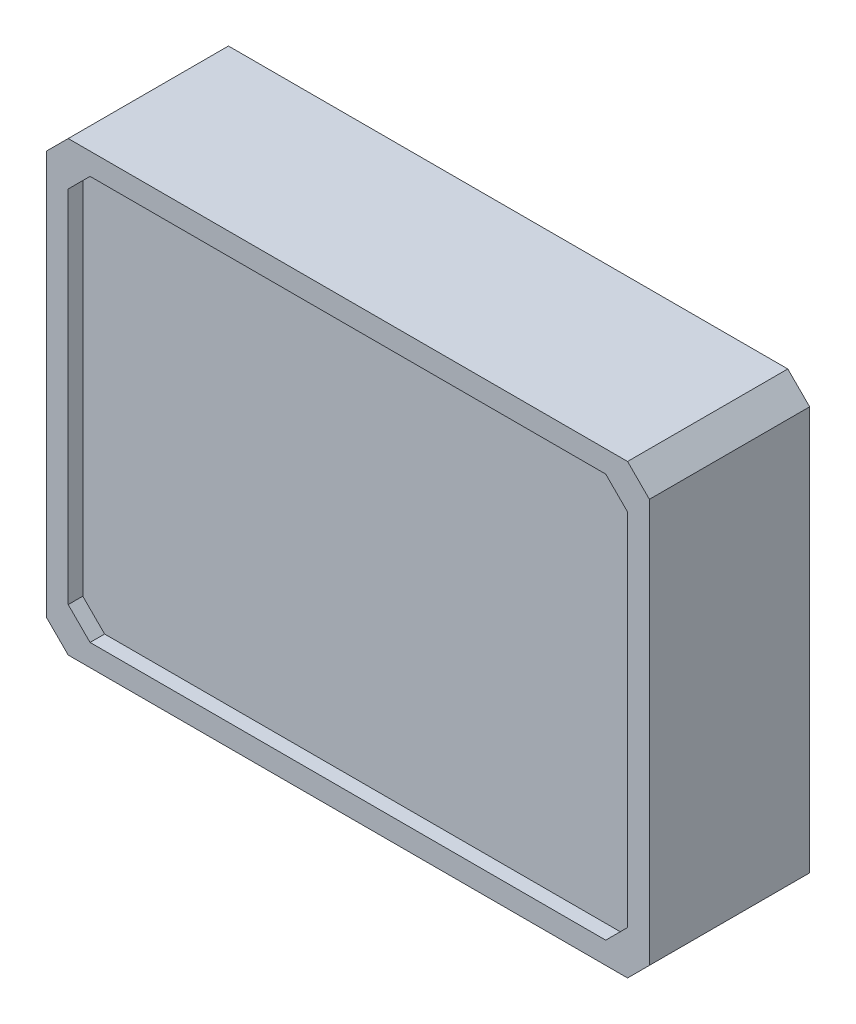
from build123d import *

# Parameters (mm, degrees)
SUPPORT_PLANE_EXACTLY_20MM_ABOVE_TABLE_DEPTH   = 20
LOW_LOCATING_LIP_0P4MM_CLEARANCE_EACH_SI_START = 20
LOW_LOCATING_LIP_0P4MM_CLEARANCE_EACH_SI_DEPTH = 2


with BuildPart() as part:
    # 草图1 → Support_plane_exactly_20mm_above_table (new body)
    with BuildSketch(Plane.XY):
        Polygon((-38.4, -30.7095), (38.4, -30.7095), (41.4, -27.7095), (41.4, 27.7095), (38.4, 30.7095), (-38.4, 30.7095), (-41.4, 27.7095), (-41.4, -27.7095), align=None)
    extrude(amount=SUPPORT_PLANE_EXACTLY_20MM_ABOVE_TABLE_DEPTH)

    # 草图2 → Low_locating_lip_0p4mm_clearance_each_side (add)
    with BuildSketch(Plane.XY.offset(LOW_LOCATING_LIP_0P4MM_CLEARANCE_EACH_SI_START)):
        Polygon((-38.4, -30.7095), (38.4, -30.7095), (41.4, -27.7095), (41.4, 27.7095), (38.4, 30.7095), (-38.4, 30.7095), (-41.4, 27.7095), (-41.4, -27.7095), align=None)
        Polygon((-35.4, -27.7095), (35.4, -27.7095), (38.4, -24.7095), (38.4, 24.7095), (35.4, 27.7095), (-35.4, 27.7095), (-38.4, 24.7095), (-38.4, -24.7095), align=None, mode=Mode.SUBTRACT)
    extrude(amount=LOW_LOCATING_LIP_0P4MM_CLEARANCE_EACH_SI_DEPTH)


solid = part.part
